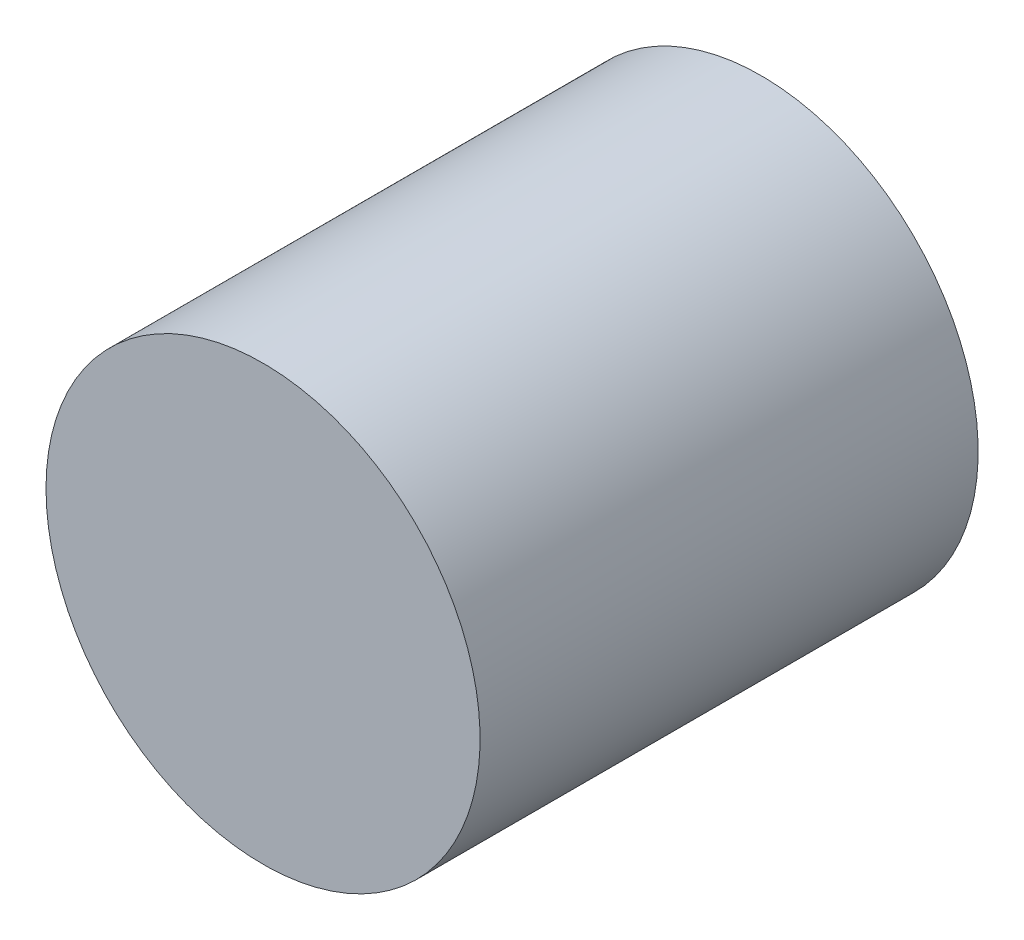
from build123d import *

# Parameters (mm, degrees)
CURVESKETCH_R   = 5.193
CURVEBOSS_DEPTH = 11.917


with BuildPart() as part:
    # CurveSketch → CurveBoss (new body)
    with BuildSketch(Plane.XY):
        with Locations(Location((-3.719, 6.137, 0), (0, 0, 180))):
            Circle(CURVESKETCH_R)
    extrude(amount=CURVEBOSS_DEPTH)


solid = part.part
